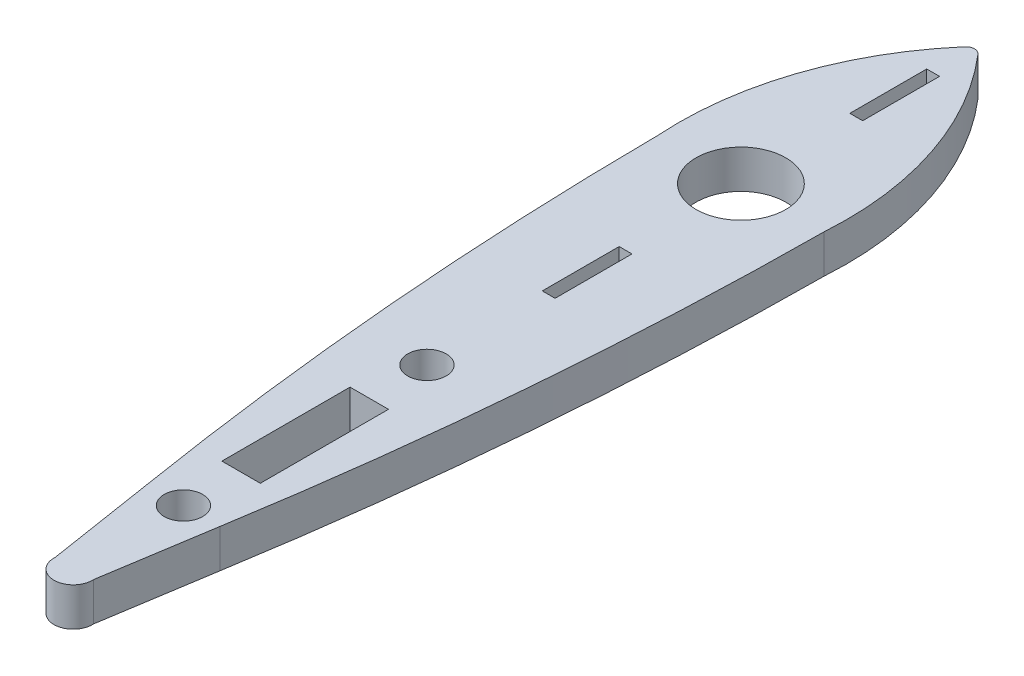
from build123d import *

# Parameters (mm, degrees)
ESBO_O1_R                = 3.5
ESBO_O1_R_2              = 1.5
RESSALTO_EXTRUS_O1_DEPTH = 3


with BuildPart() as part:
    # Esboço1 → Ressalto-extrusão1 (new body)
    with BuildSketch(Plane(origin=(0, 0, 0), x_dir=(1, 0, 0), z_dir=(0, 1, 0))):
        with BuildLine():
            Line((-1.543118166, -51.877133975), (-2.882093194, -43.377133975))
            ThreePointArc((-2.882093194, -43.377133975), (-5.555698335, -21.698089912), (-6.543118166, 0.122866025))
            ThreePointArc((-6.543118166, 0.122866025), (-5.322348439, 9.715942783), (-0.543118166, 18.122866025))
            ThreePointArc((-0.543118166, 18.122866025), (-0.043118166, 18.346048676), (0.456881834, 18.122866025))
            ThreePointArc((0.456881834, 18.122866025), (5.236112108, 9.715942783), (6.456881834, 0.122866025))
            ThreePointArc((6.456881834, 0.122866025), (5.469462003, -21.698089912), (2.795856862, -43.377133975))
            Line((2.795856862, -43.377133975), (1.456881834, -51.877133975))
            ThreePointArc((1.456881834, -51.877133975), (-0.043118166, -53.479108362), (-1.543118166, -51.877133975))
        make_face()
        with Locations(Location((-0.043118166, 0.122866025, 0), (0, 0, 270))):
            Circle(ESBO_O1_R, mode=Mode.SUBTRACT)
        with Locations(Location((-0.043118166, -24.377133975, 0), (0, 0, 270))):
            Circle(ESBO_O1_R_2, mode=Mode.SUBTRACT)
        with Locations(Location((-0.043118166, -43.377133975, 0), (0, 0, 270))):
            Circle(ESBO_O1_R_2, mode=Mode.SUBTRACT)
        Polygon((-0.043118166, -14.877133975), (-0.543118166, -14.877133975), (-0.543118166, -8.877133975), (0.456881834, -8.877133975), (0.456881834, -14.877133975), align=None, mode=Mode.SUBTRACT)
        Polygon((0.456881834, 15.122866025), (-0.043118166, 15.122866025), (-0.543118166, 15.122866025), (-0.543118166, 9.122866025), (0.456881834, 9.122866025), align=None, mode=Mode.SUBTRACT)
        Polygon((-0.043118166, -28.877133975), (1.456881834, -28.877133975), (1.456881834, -38.877133975), (-0.043118166, -38.877133975), (-1.543118166, -38.877133975), (-1.543118166, -28.877133975), align=None, mode=Mode.SUBTRACT)
    extrude(amount=RESSALTO_EXTRUS_O1_DEPTH)


solid = part.part
